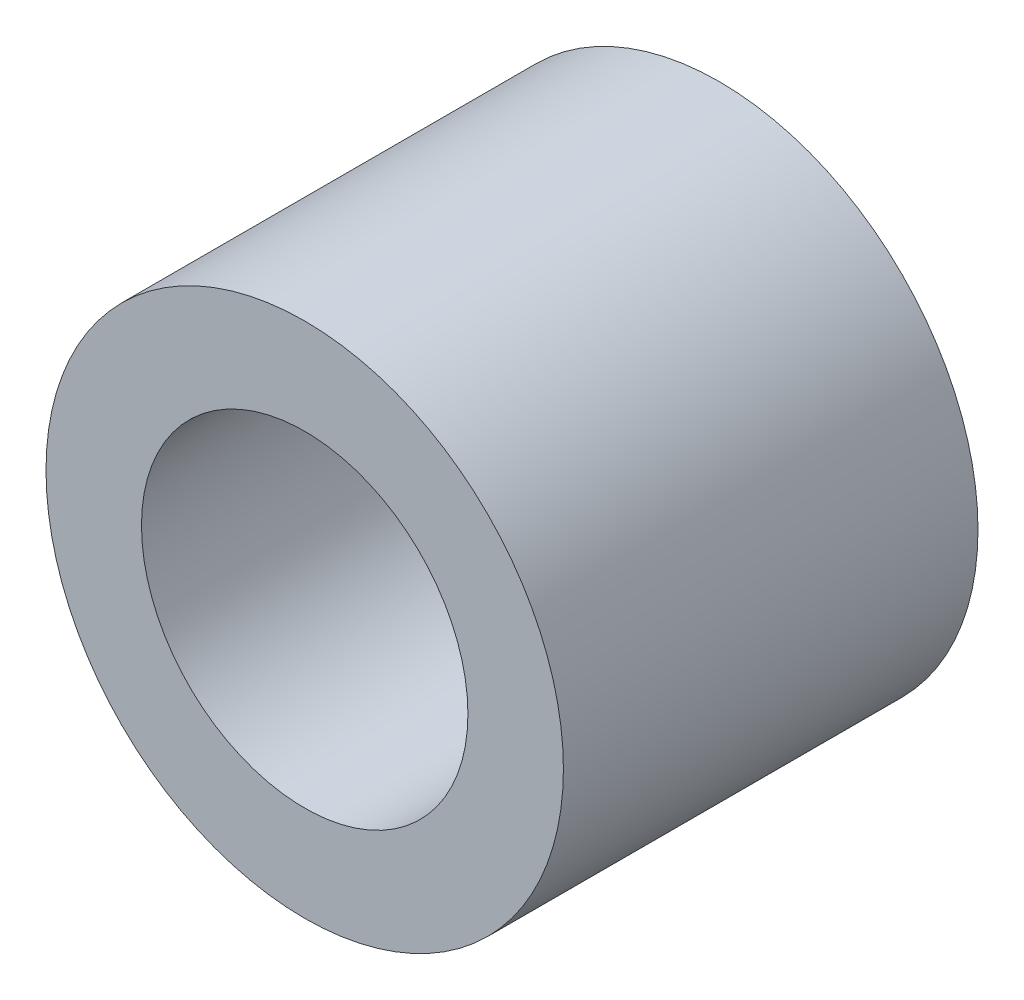
from build123d import *

# Parameters (mm, degrees)
SKETCH1_R           = 3.9624
SKETCH1_R_2         = 2.5
BOSS_EXTRUDE1_DEPTH = 6.35


with BuildPart() as part:
    # Sketch1 → Boss-Extrude1 (new body)
    with BuildSketch(Plane.XY):
        Circle(SKETCH1_R)
        Circle(SKETCH1_R_2, mode=Mode.SUBTRACT)
    extrude(amount=BOSS_EXTRUDE1_DEPTH)


solid = part.part
